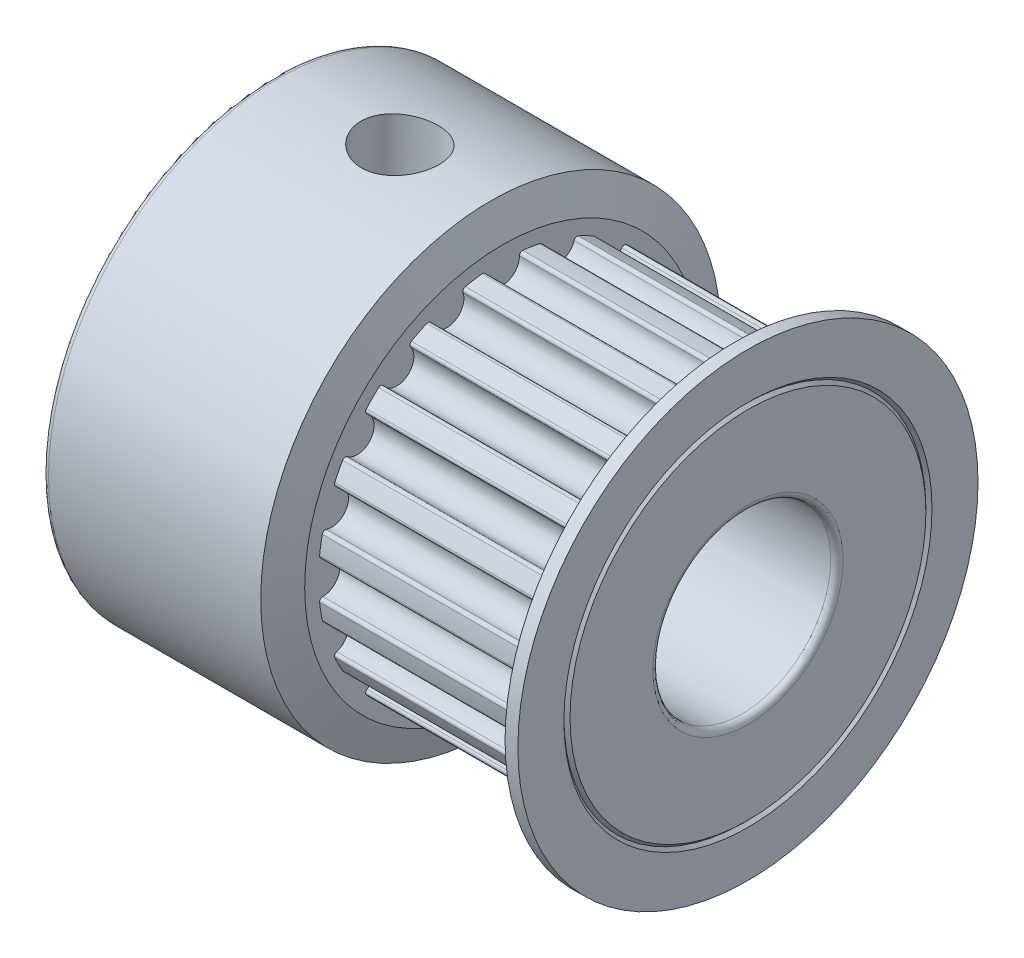
from build123d import *

# Parameters (mm, degrees)
SKETCH_3_R                = 0.55
CUT_EXTRUDE1_DEPTH        = 7.2
FILLET_2_R                = 0.1
CIRPATTERN1_COUNT         = 20
FILLET_2_OF_CIRPATTERN1_R = 0.1
M3_TAPPED_HOLE1_D         = 2.5
M3_TAPPED_HOLE1_DEPTH     = 7.5
M3_TAPPED_HOLE1_TIP       = 0.751075774
FILLET1_R                 = 0.2


with BuildPart() as part:
    # Sketch 1 → Body (revolve)
    with BuildSketch(Plane.XY, mode=Mode.PRIVATE) as body_sk:
        Polygon((-1.5, 2.9), (-1.5, 7.5), (5.617601306, 7.5), (6, 6.449368223), (6, 6), (13.2, 6), (13.2, 6.449368223), (13.582398694, 7.5), (14, 7.5), (14, 6), (13.9, 5.9), (14, 5.8), (14, 2.9), align=None)
    revolve(body_sk.sketch.rotate(Axis((1, 0, 0), (1, 0, 0)), 90), axis=Axis((1, 0, 0), (1, 0, 0)))

    # Sketch 3 → Cut-Extrude1 (cut)
    with BuildSketch(Plane(origin=(6, 0, 0), x_dir=(0, 0, -1), z_dir=(1, 0, 0))):
        with Locations((0, 5.855)):
            Circle(SKETCH_3_R)
    cut_extrude1 = extrude(amount=CUT_EXTRUDE1_DEPTH, mode=Mode.SUBTRACT)

    # Fillet 2
    fillet_2_edges = [part.edges().sort_by_distance(p)[0] for p in [
        (9.6, 5.975962852, -0.536533306),
        (9.6, 5.975962852, 0.536533306),
    ]]
    fillet(fillet_2_edges, radius=FILLET_2_R)

    # CirPattern1: Cut-Extrude1 ×20 about axis
    cirpattern1_axis = Axis((0, 0, 0), (1, 0, 0))
    for i in range(1, CIRPATTERN1_COUNT):
        add(cut_extrude1.rotate(cirpattern1_axis, i * 360 / CIRPATTERN1_COUNT), mode=Mode.SUBTRACT)

    # Fillet 2 of CirPattern1
    fillet_2_of_cirpattern1_edges = [part.edges().sort_by_distance(p)[0] for p in [
        (9.6, 5.849276321, 1.336400582),
        (9.6, 5.517680502, 2.356947576),
        (9.6, 5.15002187, 3.07851827),
        (9.6, 4.519289141, 3.946647395),
        (9.6, 3.946647395, 4.519289141),
        (9.6, 3.07851827, 5.15002187),
        (9.6, 2.356947576, 5.517680502),
        (9.6, 1.336400582, 5.849276321),
        (9.6, 0.536533306, 5.975962852),
        (9.6, -0.536533306, 5.975962852),
        (9.6, -1.336400582, 5.849276321),
        (9.6, -2.356947576, 5.517680502),
        (9.6, -3.07851827, 5.15002187),
        (9.6, -3.946647395, 4.519289141),
        (9.6, -4.519289141, 3.946647395),
        (9.6, -5.15002187, 3.07851827),
        (9.6, -5.517680502, 2.356947576),
        (9.6, -5.849276321, 1.336400582),
        (9.6, -5.975962852, 0.536533306),
        (9.6, -5.975962852, -0.536533306),
        (9.6, -5.849276321, -1.336400582),
        (9.6, -5.517680502, -2.356947576),
        (9.6, -5.15002187, -3.07851827),
        (9.6, -4.519289141, -3.946647395),
        (9.6, -3.946647395, -4.519289141),
        (9.6, -3.07851827, -5.15002187),
        (9.6, -2.356947576, -5.517680502),
        (9.6, -1.336400582, -5.849276321),
        (9.6, -0.536533306, -5.975962852),
        (9.6, 0.536533306, -5.975962852),
        (9.6, 1.336400582, -5.849276321),
        (9.6, 2.356947576, -5.517680502),
        (9.6, 3.07851827, -5.15002187),
        (9.6, 3.946647395, -4.519289141),
        (9.6, 4.519289141, -3.946647395),
        (9.6, 5.15002187, -3.07851827),
        (9.6, 5.517680502, -2.356947576),
        (9.6, 5.849276321, -1.336400582),
    ]]
    fillet(fillet_2_of_cirpattern1_edges, radius=FILLET_2_OF_CIRPATTERN1_R)

    # M3 Tapped Hole1
    with Locations(Plane(origin=(2.5, 7.498410891, -0.154382974), x_dir=(0, 0.02058439657, 0.999788118862), z_dir=(0, 0.999788118862, -0.02058439657))):
        with Locations((0, 0)):
            Hole(M3_TAPPED_HOLE1_D / 2, depth=M3_TAPPED_HOLE1_DEPTH)
            with Locations((0, 0, -(M3_TAPPED_HOLE1_DEPTH + M3_TAPPED_HOLE1_TIP / 2))):  # 118° drill point
                Cone(0, M3_TAPPED_HOLE1_D / 2, M3_TAPPED_HOLE1_TIP, mode=Mode.SUBTRACT)

    # Fillet1
    fillet1_edges = [part.edges().sort_by_distance(p)[0] for p in [
        (14, 0, -2.9),
        (-1.5, 0, -2.9),
        (-1.5, 0, -7.5),
        (2.5, 2.641948872, 1.195870459),
    ]]
    fillet(fillet1_edges, radius=FILLET1_R)


solid = part.part
